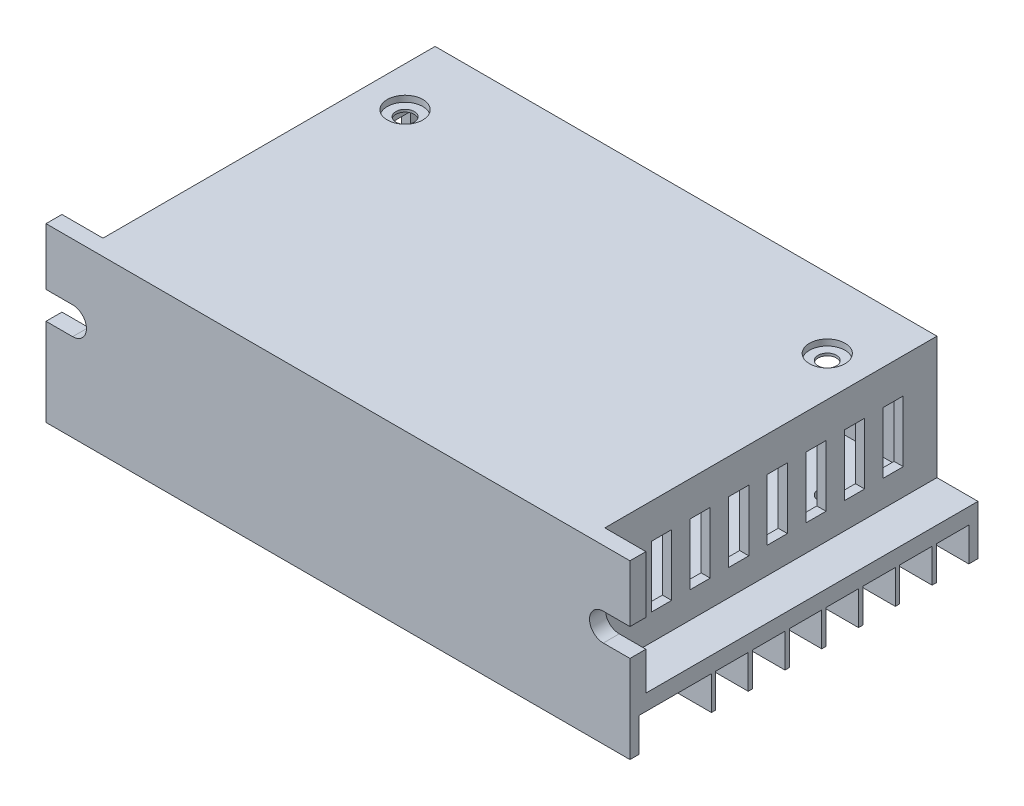
from build123d import *

# Parameters (mm, degrees)
SKETCH1_W                               = 95.3
SKETCH1_H                               = 56.8
BOSS_EXTRUDE1_DEPTH                     = 28.1
SKETCH2_W                               = 5.3
SKETCH2_H                               = 5.5
SKETCH2_W_2                             = 11.8
CUT_EXTRUDE2_DEPTH                      = 104.33566664
SKETCH3_W                               = 6.7
SKETCH3_H                               = 20
CUT_EXTRUDE4_DEPTH                      = 54.2
CUT_EXTRUDE5_DEPTH                      = 80.286647678
SKETCH5_W                               = 3.3
SKETCH5_H                               = 10
CUT_EXTRUDE6_DEPTH                      = 98.191203306
CUT_EXTRUDE8_REACH                      = 65.583
CUT_EXTRUDE8_START                      = -1.4
SKETCH6_W                               = 78.9
SKETCH6_H                               = 52.7
CUT_EXTRUDE9_REACH                      = 99.191
SKETCH7_W                               = 19
SKETCH7_H                               = 10.5
CUT_EXTRUDE10_REACH                     = 81.287
SKETCH8_W                               = 66.3
SKETCH8_H                               = 10.8
CBORE_FOR_M5_HEX_HEAD_BOLT1_D           = 3
CBORE_FOR_M5_HEX_HEAD_BOLT1_CBORE_D     = 5.8
CBORE_FOR_M5_HEX_HEAD_BOLT1_CBORE_DEPTH = 1


with BuildPart() as part:
    # Sketch1 → Boss-Extrude1 (new body)
    with BuildSketch(Plane(origin=(0, 0, 0), x_dir=(1, 0, 0), z_dir=(0, 1, 0))):
        Rectangle(SKETCH1_W, SKETCH1_H)
    extrude(amount=BOSS_EXTRUDE1_DEPTH)

    # Sketch2 → Cut-Extrude2 (cut, through all)
    with BuildSketch(Plane.ZY.offset(47.65)):
        with Locations((-24.25, 2.75)):
            Rectangle(SKETCH2_W, SKETCH2_H)
        with Locations((-18.25, 2.75)):
            Rectangle(SKETCH2_W, SKETCH2_H)
        with Locations((-12.25, 2.75)):
            Rectangle(SKETCH2_W, SKETCH2_H)
        with Locations((-6.25, 2.75)):
            Rectangle(SKETCH2_W, SKETCH2_H)
        with Locations((-0.25, 2.75)):
            Rectangle(SKETCH2_W, SKETCH2_H)
        with Locations((5.75, 2.75)):
            Rectangle(SKETCH2_W, SKETCH2_H)
        with Locations((11.75, 2.75)):
            Rectangle(SKETCH2_W, SKETCH2_H)
        with Locations((21, 2.75)):
            Rectangle(SKETCH2_W_2, SKETCH2_H)
    extrude(amount=-CUT_EXTRUDE2_DEPTH, mode=Mode.SUBTRACT)

    # Sketch3 → Cut-Extrude4 (cut)
    with BuildSketch(Plane(origin=(0, 0, -28.4), x_dir=(-1, 0, 0), z_dir=(0, 0, -1))):
        with Locations((-44.3, 18.1)):
            Rectangle(SKETCH3_W, SKETCH3_H)
        with Locations((44.3, 18.1)):
            Rectangle(SKETCH3_W, SKETCH3_H)
    extrude(amount=-CUT_EXTRUDE4_DEPTH, mode=Mode.SUBTRACT)

    # Sketch4 → Cut-Extrude5 (cut, through all)
    with BuildSketch(Plane.XY.offset(28.4)):
        with BuildLine():
            Line((43.3, 18.8), (52, 18.8))
            ThreePointArc((52, 18.8), (54.25, 16.55), (52, 14.3))
            Line((52, 14.3), (43.3, 14.3))
            ThreePointArc((43.3, 14.3), (41.05, 16.55), (43.3, 18.8))
        make_face()
    cut_extrude5 = extrude(amount=-CUT_EXTRUDE5_DEPTH, mode=Mode.SUBTRACT)

    # Mirror1: Cut-Extrude5 across plane
    add(cut_extrude5.mirror(Plane(origin=(0, 0, 0), x_dir=(0, 0, 1), z_dir=(1, 0, 0))), mode=Mode.SUBTRACT)

    # Sketch5 → Cut-Extrude6 (cut, through all)
    with BuildSketch(Plane(origin=(40.95, 0, 0), x_dir=(0, 0, -1), z_dir=(1, 0, 0))):
        with Locations((-16.55, 17.4)):
            Rectangle(SKETCH5_W, SKETCH5_H)
        with Locations((-10.25, 17.4)):
            Rectangle(SKETCH5_W, SKETCH5_H)
        with Locations((-3.95, 17.4)):
            Rectangle(SKETCH5_W, SKETCH5_H)
        with Locations((2.35, 17.4)):
            Rectangle(SKETCH5_W, SKETCH5_H)
        with Locations((8.65, 17.4)):
            Rectangle(SKETCH5_W, SKETCH5_H)
        with Locations((14.95, 17.4)):
            Rectangle(SKETCH5_W, SKETCH5_H)
        with Locations((21.25, 17.4)):
            Rectangle(SKETCH5_W, SKETCH5_H)
    extrude(amount=-CUT_EXTRUDE6_DEPTH, mode=Mode.SUBTRACT)

    # Cut-Extrude8: up to this face of the body (flat: up to its plane)
    cut_extrude8_end = Plane(part.part.faces().sort_by_distance((-44.3, 8.1, -1.3))[0])
    # Sketch6 → Cut-Extrude8 (cut, up to the picked face)
    with BuildSketch(Plane(origin=(0, 28.1, 0), x_dir=(1, 0, 0), z_dir=(0, 1, 0)).offset(CUT_EXTRUDE8_START), mode=Mode.PRIVATE) as cut_extrude8_sk1:
        with Locations((0, 0.55)):
            Rectangle(SKETCH6_W, SKETCH6_H)
    cut_extrude8_tool1 = split(extrude(cut_extrude8_sk1.sketch, amount=-CUT_EXTRUDE8_REACH, mode=Mode.PRIVATE), bisect_by=cut_extrude8_end, keep=Keep.BOTH, mode=Mode.PRIVATE)
    add(cut_extrude8_tool1.solids().sort_by(Axis((0, 26.7, -0.55), (0, -1, 0)))[0], mode=Mode.SUBTRACT)

    # Sketch7 → Cut-Extrude9 (cut, up to next)
    with BuildSketch(Plane.ZY.offset(40.95), mode=Mode.PRIVATE) as cut_extrude9_sk1:
        with Locations((-3, 19.75)):
            Rectangle(SKETCH7_W, SKETCH7_H)
    cut_extrude9_tool1 = extrude(cut_extrude9_sk1.sketch, amount=-CUT_EXTRUDE9_REACH, mode=Mode.PRIVATE) & part.part
    add(cut_extrude9_tool1.solids().sort_by_distance((-40.95, 19.75, -3))[0], mode=Mode.SUBTRACT)

    # Sketch8 → Cut-Extrude10 (cut, up to next)
    with BuildSketch(Plane(origin=(0, 0, -28.4), x_dir=(-1, 0, 0), z_dir=(0, 0, -1)), mode=Mode.PRIVATE) as cut_extrude10_sk1:
        with Locations((0, 18.9)):
            Rectangle(SKETCH8_W, SKETCH8_H)
    cut_extrude10_tool1 = extrude(cut_extrude10_sk1.sketch, amount=-CUT_EXTRUDE10_REACH, mode=Mode.PRIVATE) & part.part
    add(cut_extrude10_tool1.solids().sort_by_distance((0, 18.9, -28.4))[0], mode=Mode.SUBTRACT)

    # CBORE for M5 Hex Head Bolt1 (through all)
    with Locations(Plane(origin=(0, 28.1, 0), x_dir=(1, 0, 0), z_dir=(0, 1, 0))):
        with Locations((-34.45, 17)):
            cbore_for_m5_hex_head_bolt1 = CounterBoreHole(CBORE_FOR_M5_HEX_HEAD_BOLT1_D / 2, CBORE_FOR_M5_HEX_HEAD_BOLT1_CBORE_D / 2, CBORE_FOR_M5_HEX_HEAD_BOLT1_CBORE_DEPTH)

    # Mirror2: CBORE for M5 Hex Head Bolt1 across plane
    add(cbore_for_m5_hex_head_bolt1.mirror(Plane(origin=(0, 0, 0), x_dir=(0, 0, 1), z_dir=(1, 0, 0))), mode=Mode.SUBTRACT)


solid = part.part
